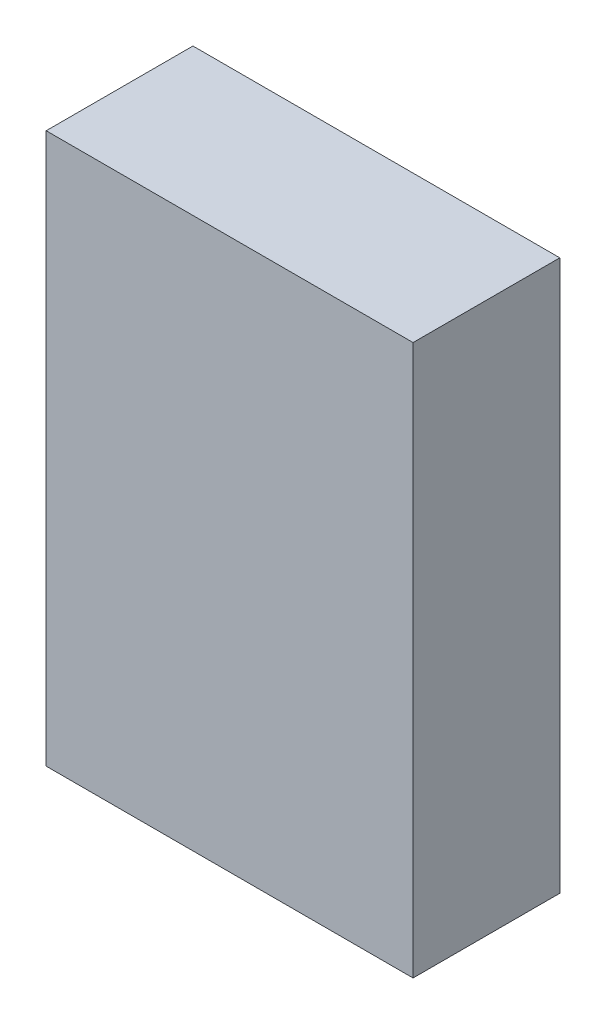
from build123d import *

# Parameters (mm, degrees)
ESQUISSE1_W             = 200
ESQUISSE1_H             = 300
BOSS_EXTRU_1_DEPTH      = 80
COQUE1_T                = -4
ESQUISSE3_W             = 196.2
ESQUISSE3_H             = 296.2
ENL_V_MAT_EXTRU_2_DEPTH = 4.1
ESQUISSE4_R             = 9
BOSS_EXTRU_2_DEPTH      = 67.9
ESQUISSE5_R             = 2.5
ENL_V_MAT_EXTRU_3_DEPTH = 30
ESQUISSE4_4_R           = 9
BOSS_EXTRU_3_DEPTH      = 15
ESQUISSE6_R             = 2.5
ENL_V_MAT_EXTRU_6_DEPTH = 10
ESQUISSE8_R             = 9
BOSS_EXTRU_5_DEPTH      = 68
ESQUISSE9_R             = 2.5
ENL_V_MAT_EXTRU_8_DEPTH = 30


with BuildPart() as part:
    # Esquisse1 → Boss.-Extru.1 (new body)
    with BuildSketch(Plane.XY):
        with Locations((43.373964051, -118.711656442)):
            Rectangle(ESQUISSE1_W, ESQUISSE1_H)
    extrude(amount=BOSS_EXTRU_1_DEPTH)

    # Coque1
    coque1_openings = [part.faces().sort_by_distance(p)[0] for p in [
        (43.373964051, -118.711656442, 0),
    ]]
    offset(amount=COQUE1_T, openings=coque1_openings, kind=Kind.INTERSECTION)

    # Esquisse3 → Enlèv. mat.-Extru.2 (cut)
    with BuildSketch(Plane(origin=(0, 0, 0), x_dir=(-1, 0, 0), z_dir=(0, 0, -1))):
        with Locations((-43.373964051, -118.711656442)):
            Rectangle(ESQUISSE3_W, ESQUISSE3_H)
    extrude(amount=-ENL_V_MAT_EXTRU_2_DEPTH, mode=Mode.SUBTRACT)

    # Esquisse4 → Boss.-Extru.2 (add)
    with BuildSketch(Plane(origin=(0, 0, 76), x_dir=(-1, 0, 0), z_dir=(0, 0, -1))):
        with Locations((-119.373964051, 7.288343558)):
            Circle(ESQUISSE4_R)
    extrude(amount=BOSS_EXTRU_2_DEPTH)

    # Esquisse5 → Enlèv. mat.-Extru.3 (cut)
    with BuildSketch(Plane(origin=(0, 0, 8.1), x_dir=(-1, 0, 0), z_dir=(0, 0, -1))):
        with Locations((-119.373964051, 7.288343558)):
            Circle(ESQUISSE5_R)
    extrude(amount=-ENL_V_MAT_EXTRU_3_DEPTH, mode=Mode.SUBTRACT)

    # Esquisse4<4> → Boss.-Extru.3 (add)
    with BuildSketch(Plane(origin=(0, 0, 76), x_dir=(-1, 0, 0), z_dir=(0, 0, -1))):
        with Locations((2.626035949, -174.711656442)):
            Circle(ESQUISSE4_4_R)
        with Locations((-89.373964051, -174.711656442)):
            Circle(ESQUISSE4_4_R)
        with Locations((-89.373964051, -62.711656442)):
            Circle(ESQUISSE4_4_R)
        with Locations((2.626035949, -62.711656442)):
            Circle(ESQUISSE4_4_R)
    extrude(amount=BOSS_EXTRU_3_DEPTH)

    # Esquisse6 → Enlèv. mat.-Extru.6 (cut)
    with BuildSketch(Plane(origin=(0, 0, 61), x_dir=(-1, 0, 0), z_dir=(0, 0, -1))):
        with Locations((-89.373964051, -62.711656442)):
            Circle(ESQUISSE6_R)
        with Locations((2.626035949, -62.711656442)):
            Circle(ESQUISSE6_R)
        with Locations((-89.373964051, -174.711656442)):
            Circle(ESQUISSE6_R)
        with Locations((2.626035949, -174.711656442)):
            Circle(ESQUISSE6_R)
    extrude(amount=-ENL_V_MAT_EXTRU_6_DEPTH, mode=Mode.SUBTRACT)

    # Esquisse8 → Boss.-Extru.5 (add)
    with BuildSketch(Plane(origin=(0, 0, 76), x_dir=(-1, 0, 0), z_dir=(0, 0, -1))):
        with Locations((32.626035949, 7.288343558)):
            Circle(ESQUISSE8_R)
        with Locations((32.626035949, -244.711656442)):
            Circle(ESQUISSE8_R)
        with Locations((-119.373964051, -244.711656442)):
            Circle(ESQUISSE8_R)
    extrude(amount=BOSS_EXTRU_5_DEPTH)

    # Esquisse9 → Enlèv. mat.-Extru.8 (cut)
    with BuildSketch(Plane(origin=(0, 0, 8), x_dir=(-1, 0, 0), z_dir=(0, 0, -1))):
        with Locations((32.626035949, 7.288343558)):
            Circle(ESQUISSE9_R)
        with Locations((32.626035949, -244.711656442)):
            Circle(ESQUISSE9_R)
        with Locations((-119.373964051, -244.711656442)):
            Circle(ESQUISSE9_R)
    extrude(amount=-ENL_V_MAT_EXTRU_8_DEPTH, mode=Mode.SUBTRACT)


solid = part.part
